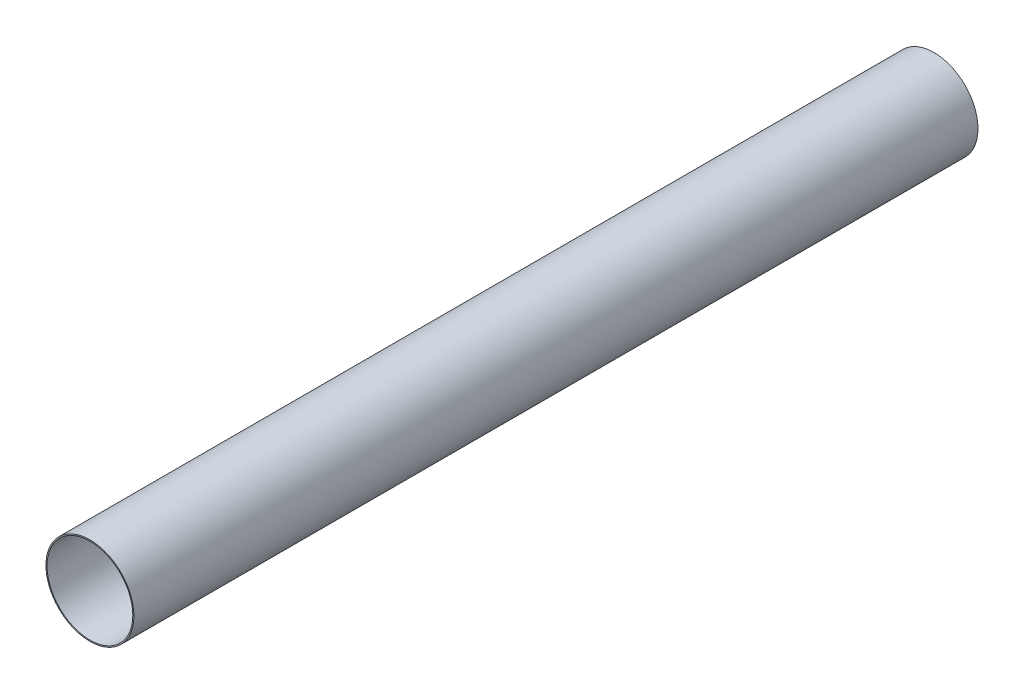
from build123d import *

# Parameters (mm, degrees)
SKETCH1_R           = 78.2
SKETCH1_R_2         = 76.2
BOSS_EXTRUDE1_DEPTH = 1500


with BuildPart() as part:
    # Sketch1 → Boss-Extrude1 (new body)
    with BuildSketch(Plane.XY):
        Circle(SKETCH1_R)
        Circle(SKETCH1_R_2, mode=Mode.SUBTRACT)
    extrude(amount=BOSS_EXTRUDE1_DEPTH)


solid = part.part
